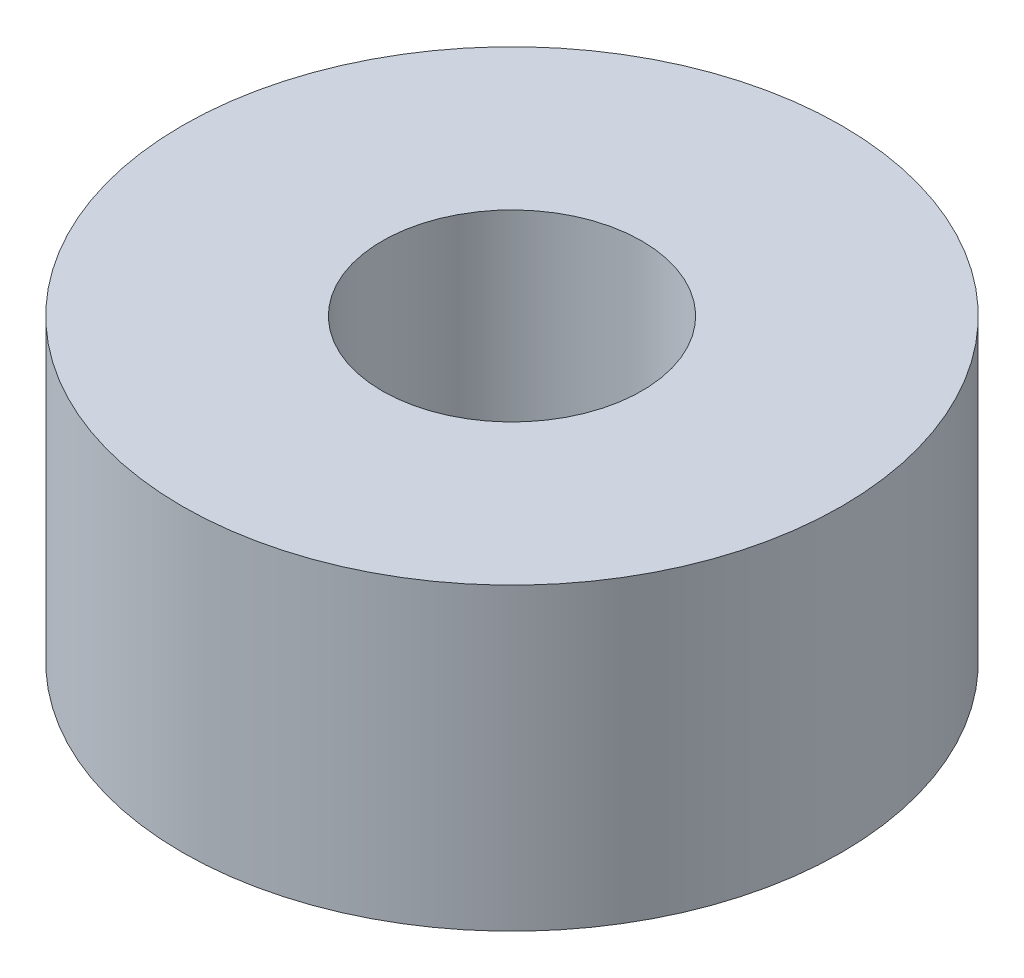
from build123d import *

# Parameters (mm, degrees)
SKETCH1_R           = 3.3
SKETCH1_R_2         = 1.3
BOSS_EXTRUDE1_DEPTH = 3


with BuildPart() as part:
    # Sketch1 → Boss-Extrude1 (new body)
    with BuildSketch(Plane(origin=(0, 0, 0), x_dir=(1, 0, 0), z_dir=(0, 1, 0))):
        with Locations(Location((0, 0, 0), (0, 0, 270))):
            Circle(SKETCH1_R)
        with Locations(Location((0, 0, 0), (0, 0, 270))):
            Circle(SKETCH1_R_2, mode=Mode.SUBTRACT)
    extrude(amount=BOSS_EXTRUDE1_DEPTH)


solid = part.part
